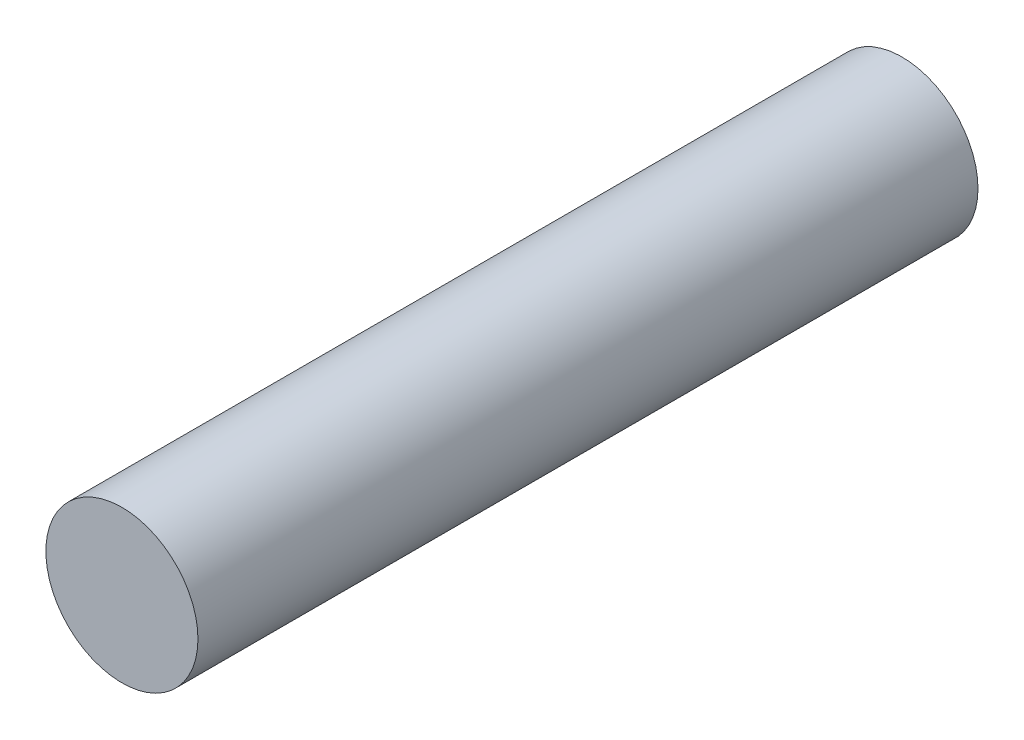
from build123d import *

# Parameters (mm, degrees)
SKETCH1_R           = 2.4765
BOSS_EXTRUDE1_DEPTH = 12.7


with BuildPart() as part:
    # Sketch1 → Boss-Extrude1 (new, symmetric)
    with BuildSketch(Plane.XY):
        Circle(SKETCH1_R)
    extrude(amount=BOSS_EXTRUDE1_DEPTH, both=True)


solid = part.part
